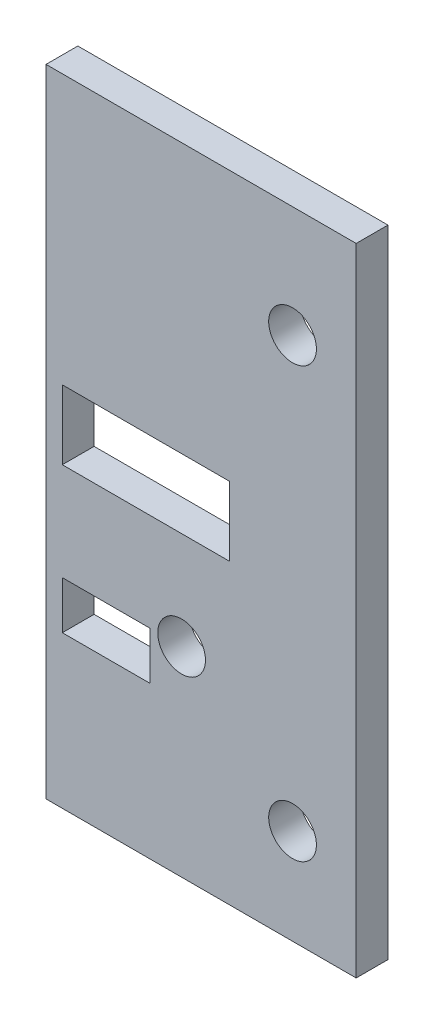
from build123d import *

# Parameters (mm, degrees)
SKETCH1_W           = 19.5
SKETCH1_H           = 40
BOSS_EXTRUDE1_DEPTH = 2
SKETCH2_R           = 1.5
SKETCH2_W           = 5.5
SKETCH2_H           = 3
SKETCH2_W_2         = 10.5
SKETCH2_H_2         = 4.353558907
CUT_EXTRUDE1_DEPTH  = 2
SKETCH3_R           = 1.5
CUT_EXTRUDE2_DEPTH  = 2


with BuildPart() as part:
    # Sketch1 → Boss-Extrude1 (new body)
    with BuildSketch(Plane.XY):
        Rectangle(SKETCH1_W, SKETCH1_H)
    extrude(amount=BOSS_EXTRUDE1_DEPTH)

    # Sketch2 → Cut-Extrude1 (cut)
    with BuildSketch(Plane.XY.offset(2)):
        with Locations((-1.226480499, -7.435998593)):
            Circle(SKETCH2_R)
        with Locations((-5.976480499, -8.935998593)):
            Rectangle(SKETCH2_W, SKETCH2_H)
        with Locations((-3.476480499, 0.887221953)):
            Rectangle(SKETCH2_W_2, SKETCH2_H_2)
    extrude(amount=-CUT_EXTRUDE1_DEPTH, mode=Mode.SUBTRACT)

    # Sketch3 → Cut-Extrude2 (cut)
    with BuildSketch(Plane.XY.offset(2)):
        with Locations((5.75, -14)):
            Circle(SKETCH3_R)
        with Locations((5.75, 13)):
            Circle(SKETCH3_R)
    extrude(amount=-CUT_EXTRUDE2_DEPTH, mode=Mode.SUBTRACT)


solid = part.part
